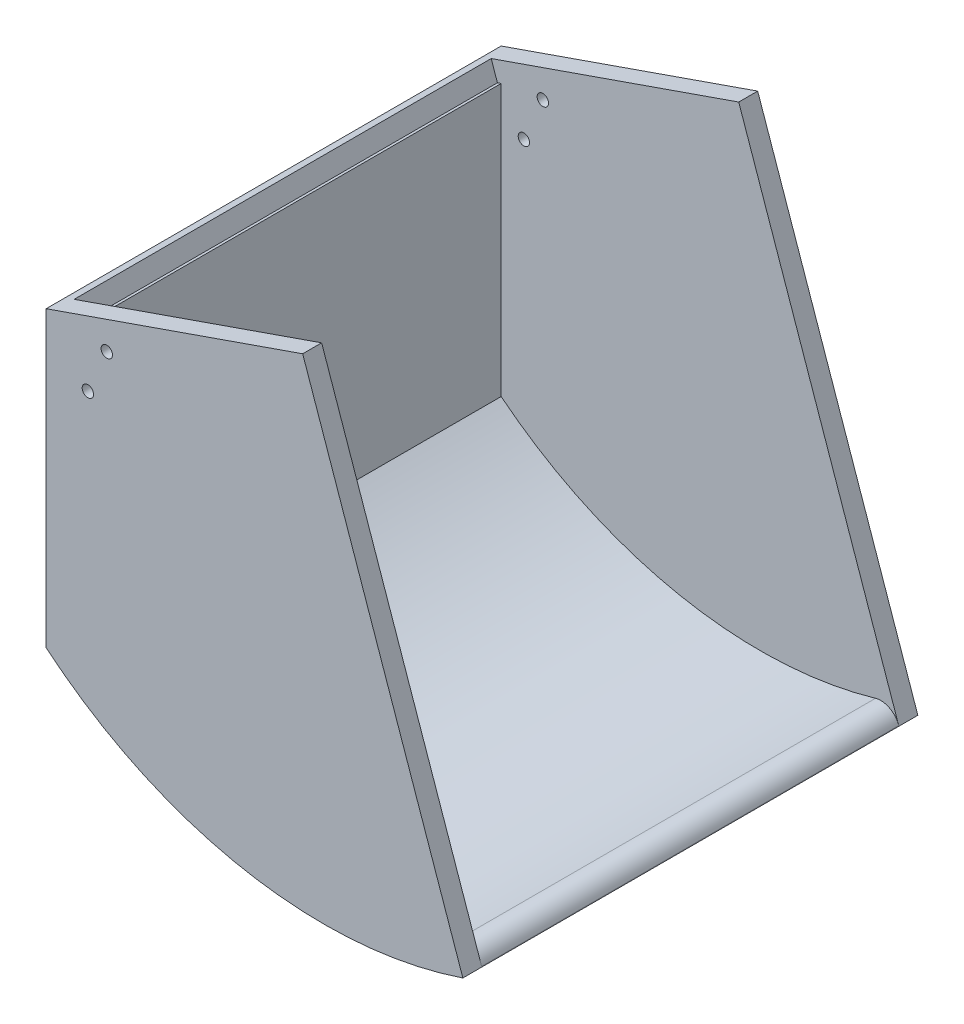
from build123d import *

# Parameters (mm, degrees)
EXTRUDE_2_DEPTH          = 110
SHELL_5_T                = 5
SKETCH_2_W               = 69.117640956
SKETCH_2_H               = 110
CUT_EXTRUDE_2_DEPTH      = 5
CUT_EXTRUDE_5_DEPTH      = 188.422981916
CUT_EXTRUDE_5_DEPTH_BACK = 188.422981916
SKETCH_3_R               = 1.5
FILLET_2_R               = 5


with BuildPart() as part:
    # 草图1 → 凸台-拉伸2 (new body)
    with BuildSketch(Plane.XY):
        with BuildLine():
            Line((0, 0), (0, 71.515747703))
            Line((0, 71.515747703), (64.301044277, 93.881328321))
            Line((64.301044277, 93.881328321), (103.260442774, -18.126942356))
            ThreePointArc((103.260442774, -18.126942356), (49.31823123, -22.233763367), (0, 0))
        make_face()
    extrude(amount=EXTRUDE_2_DEPTH)

    # 抽壳5
    shell_5_openings = [part.faces().sort_by_distance(p)[0] for p in [
        (83.780743525, 37.877192982, 55),
    ]]
    offset(amount=SHELL_5_T, openings=shell_5_openings, kind=Kind.INTERSECTION)

    # 草图2 → 切除-拉伸2 (cut)
    with BuildSketch(Plane(origin=(-23.832986898, 68.51983733, 0), x_dir=(0.9444967967061592, 0.32852062494127277, 0), z_dir=(-0.3285206249412727, 0.944496796706159, 0))):
        with Locations((57.015262517, -55)):
            Rectangle(SKETCH_2_W, SKETCH_2_H)
    extrude(amount=-CUT_EXTRUDE_2_DEPTH, mode=Mode.SUBTRACT)

    # 草图3 → 切除-拉伸5 (cut, two sides: drawn at the far end of the back side and taken through both)
    with BuildSketch(Plane.XY.offset(115).offset(-CUT_EXTRUDE_5_DEPTH_BACK)):
        with Locations((11, 73.245743445)):
            Circle(SKETCH_3_R)
        with Locations((6, 61.732695858)):
            Circle(SKETCH_3_R)
    extrude(amount=CUT_EXTRUDE_5_DEPTH + CUT_EXTRUDE_5_DEPTH_BACK, mode=Mode.SUBTRACT)

    # 圆角2
    fillet_2_edges = [part.edges().sort_by_distance(p)[0] for p in [
        (103.260442774, -18.126942356, 55),
    ]]
    fillet(fillet_2_edges, radius=FILLET_2_R)


solid = part.part
